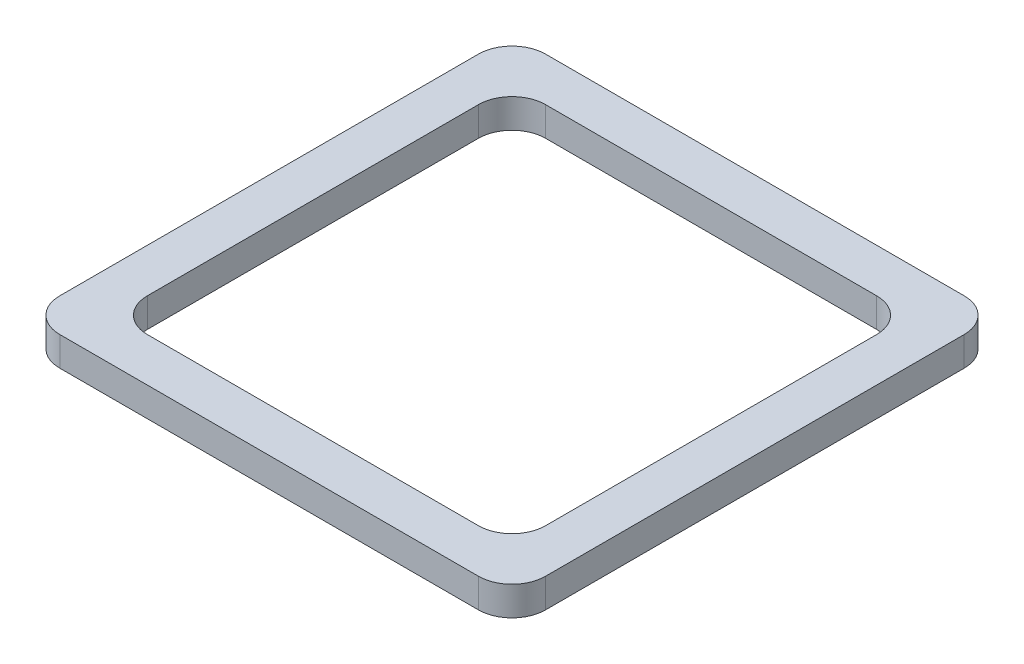
from build123d import *

# Parameters (mm, degrees)
SKETCH1_W           = 16.65
SKETCH1_H           = 16.65
BOSS_EXTRUDE1_DEPTH = 1
FILLET1_R           = 1.15


with BuildPart() as part:
    # Sketch1 → Boss-Extrude1 (new body)
    with BuildSketch(Plane(origin=(0, 0, 0), x_dir=(1, 0, 0), z_dir=(0, 1, 0))):
        Rectangle(SKETCH1_W, SKETCH1_H)
        with BuildLine():
            Line((5.675, -6.825), (-5.675, -6.825))
            ThreePointArc((-5.675, -6.825), (-6.488172798, -6.488172798), (-6.825, -5.675))
            Line((-6.825, -5.675), (-6.825, 5.675))
            ThreePointArc((-6.825, 5.675), (-6.488172798, 6.488172798), (-5.675, 6.825))
            Line((-5.675, 6.825), (5.675, 6.825))
            ThreePointArc((5.675, 6.825), (6.488172798, 6.488172798), (6.825, 5.675))
            Line((6.825, 5.675), (6.825, -5.675))
            ThreePointArc((6.825, -5.675), (6.488172798, -6.488172798), (5.675, -6.825))
        make_face(mode=Mode.SUBTRACT)
    extrude(amount=BOSS_EXTRUDE1_DEPTH)

    # Fillet1
    fillet1_edges = [part.edges().sort_by_distance(p)[0] for p in [
        (-8.325, 0.5, -8.325),
        (-8.325, 0.5, 8.325),
        (8.325, 0.5, 8.325),
        (8.325, 0.5, -8.325),
    ]]
    fillet(fillet1_edges, radius=FILLET1_R)


solid = part.part
